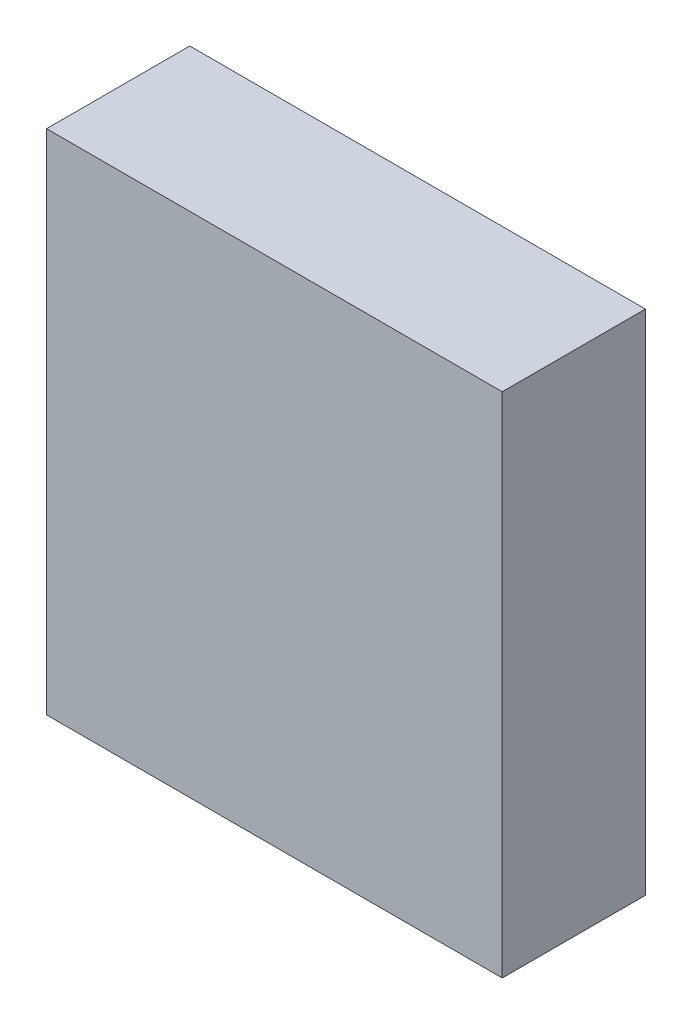
from build123d import *

# Parameters (mm, degrees)
SKETCH_1_W      = 1.75
SKETCH_1_H      = 1.95
EXTRUDE_1_DEPTH = 0.55


with BuildPart() as part:
    # 草图1 → 凸台-拉伸1 (new body)
    with BuildSketch(Plane.XY):
        Rectangle(SKETCH_1_W, SKETCH_1_H)
    extrude(amount=EXTRUDE_1_DEPTH)


solid = part.part
